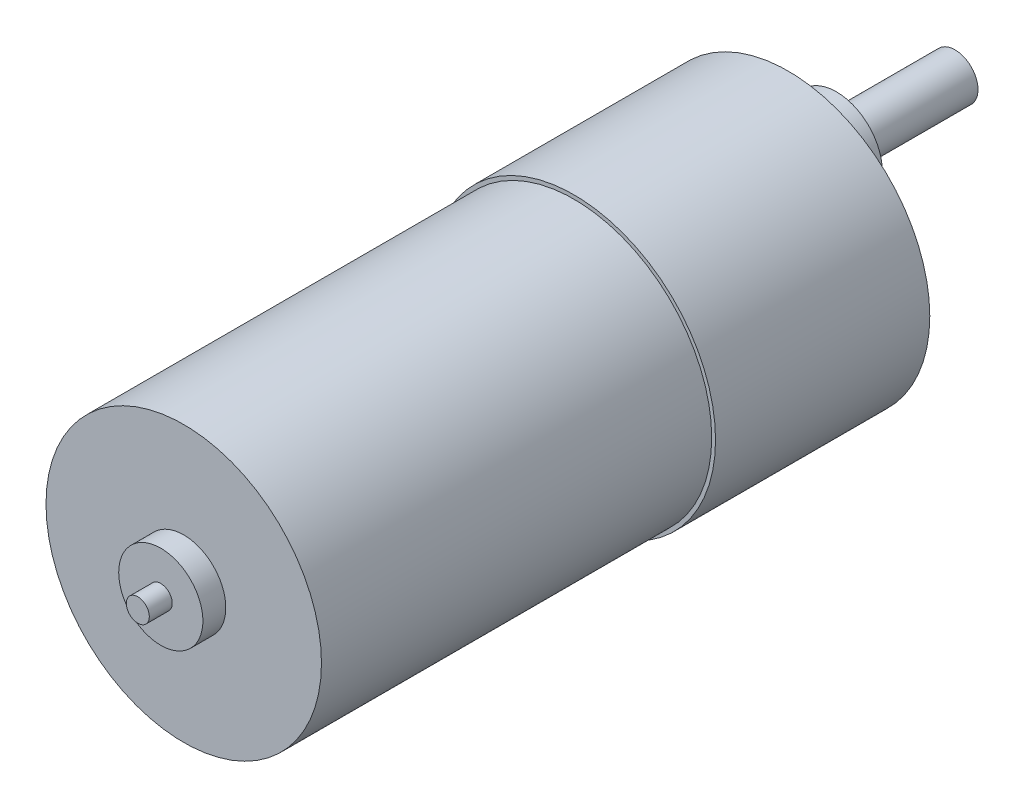
from build123d import *

# Parameters (mm, degrees)
SKETCH2_R                 = 6
BOSS_EXTRUDE1_DEPTH       = 6.3
SKETCH3_R                 = 3
BOSS_EXTRUDE2_DEPTH       = 15.5
M3X0_5_TAPPED_HOLE1_D     = 2.5
M3X0_5_TAPPED_HOLE1_DEPTH = 3.5
M3X0_5_TAPPED_HOLE1_TIP   = 0.751075774
CUT_EXTRUDE1_START        = -12
CUT_EXTRUDE1_DEPTH        = 12


with BuildPart() as part:
    # Sketch1 → Revolve1 (revolve)
    with BuildSketch(Plane(origin=(0, 0, 0), x_dir=(0, 0, -1), z_dir=(1, 0, 0)), mode=Mode.PRIVATE) as revolve1_sk:
        Polygon((0, 0), (0, -1.5), (3, -1.5), (3, -5.5), (6, -5.5), (6, -18), (57, -18), (57, -18.5), (85, -18.5), (85, 0), align=None)
    revolve(revolve1_sk.sketch.rotate(Axis((0, 0, -33.870967742), (0, 0, 1)), 270), axis=Axis((0, 0, -33.870967742), (0, 0, 1)))

    # Sketch2 → Boss-Extrude1 (add)
    with BuildSketch(Plane(origin=(0, 0, -85), x_dir=(-1, 0, 0), z_dir=(0, 0, -1))):
        with Locations(Location((0, 7, 0), (0, 0, 180))):
            Circle(SKETCH2_R)
    extrude(amount=BOSS_EXTRUDE1_DEPTH)

    # Sketch3 → Boss-Extrude2 (add)
    with BuildSketch(Plane(origin=(0, 0, -91.3), x_dir=(-1, 0, 0), z_dir=(0, 0, -1))):
        with Locations((0, 7)):
            Circle(SKETCH3_R)
    extrude(amount=BOSS_EXTRUDE2_DEPTH)

    # M3x0.5 Tapped Hole1
    with Locations(Plane(origin=(0, 0, -85), x_dir=(-1, 0, 0), z_dir=(0, 0, -1))):
        with Locations((7.75, -13.423393759), (15.5, 0), (-15.5, 0), (7.75, 13.423393759)):
            Hole(M3X0_5_TAPPED_HOLE1_D / 2, depth=M3X0_5_TAPPED_HOLE1_DEPTH)
            with Locations((0, 0, -(M3X0_5_TAPPED_HOLE1_DEPTH + M3X0_5_TAPPED_HOLE1_TIP / 2))):  # 118° drill point
                Cone(0, M3X0_5_TAPPED_HOLE1_D / 2, M3X0_5_TAPPED_HOLE1_TIP, mode=Mode.SUBTRACT)

    # Sketch6 → Cut-Extrude1 (cut)
    with BuildSketch(Plane(origin=(0, 0, -106.8), x_dir=(-1, 0, 0), z_dir=(0, 0, -1)).offset(CUT_EXTRUDE1_START)):
        with BuildLine():
            Line((-1.658312395, 4.5), (1.658312395, 4.5))
            ThreePointArc((1.658312395, 4.5), (0, 4), (-1.658312395, 4.5))
        make_face()
    extrude(amount=CUT_EXTRUDE1_DEPTH, mode=Mode.SUBTRACT)


solid = part.part
